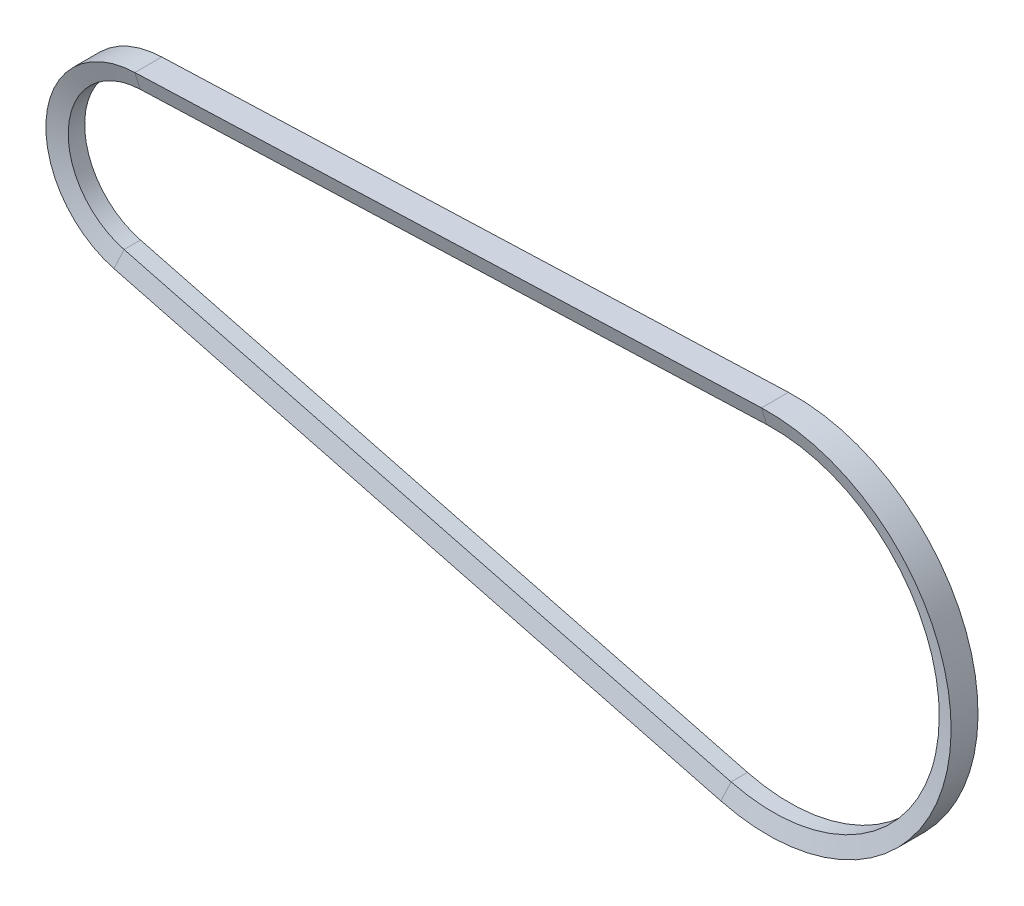
from build123d import *


with BuildPart() as part:
    # Sweep1: sweep along a path in Sketch2
    with BuildLine(Plane.XY) as sweep1_path:
        Line((-34.167084958, -131.638179513), (-530.383974062, -2.84359522))
        ThreePointArc((-530.383974062, -2.84359522), (-575.699115264, 62.816664301), (-517.290025535, 117.159188529))
        Line((-517.290025535, 117.159188529), (-4.974019391, 135.909010485))
        ThreePointArc((-4.974019391, 135.909010485), (135.197563704, -14.751907287), (-34.167084958, -131.638179513))
    # Sketch3 → Sweep1 (sweep)
    with BuildSketch(Plane(origin=(-4.974019391, 0, 0), x_dir=(0, 0, -1), z_dir=(1, 0, 0))):
        Polygon((-7.571960098, 135.909010485), (5.868039902, 135.909010485), (10.148039902, 149.908259692), (-11.851960098, 149.908259692), align=None)
    sweep(path=sweep1_path.line)


solid = part.part
